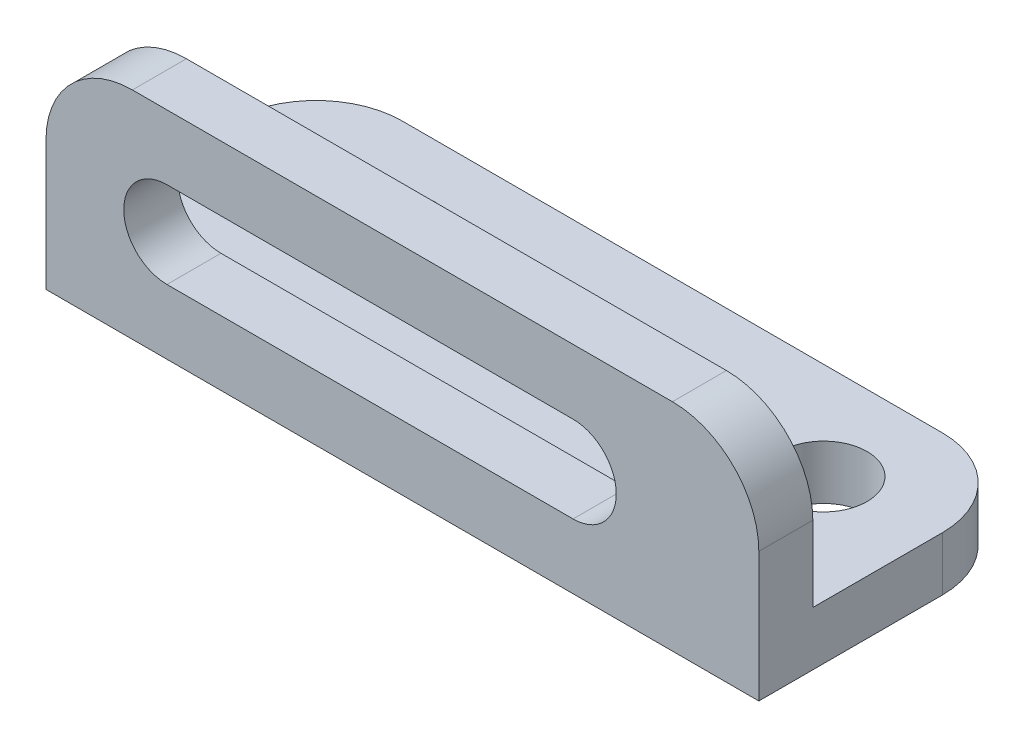
from build123d import *

# Parameters (mm, degrees)
SKETCH1_W           = 41.91
SKETCH1_H           = 15.875
BOSS_EXTRUDE1_DEPTH = 12.7
SKETCH2_W           = 12.7
SKETCH2_H           = 9.525
CUT_EXTRUDE1_DEPTH  = 46.263519803
CUT_EXTRUDE2_DEPTH  = 28.045335088
HOLE1_D             = 5.1054
HOLE1_DEPTH         = 12.7
FILLET1_R           = 5.08


with BuildPart() as part:
    # Sketch1 → Boss-Extrude1 (new body)
    with BuildSketch(Plane(origin=(0, 6.35, 0), x_dir=(1, 0, 0), z_dir=(0, 1, 0))):
        with Locations((0, 7.9375)):
            Rectangle(SKETCH1_W, SKETCH1_H)
    extrude(amount=-BOSS_EXTRUDE1_DEPTH)

    # Sketch2 → Cut-Extrude1 (cut, through all)
    with BuildSketch(Plane(origin=(20.955, 0, 0), x_dir=(0, 0, -1), z_dir=(1, 0, 0))):
        with Locations((9.525, 1.5875)):
            Rectangle(SKETCH2_W, SKETCH2_H)
    extrude(amount=-CUT_EXTRUDE1_DEPTH, mode=Mode.SUBTRACT)

    # Sketch3 → Cut-Extrude2 (cut, through all)
    with BuildSketch(Plane.XY):
        with BuildLine():
            Line((-13.843, -2.54), (10.033, -2.54))
            ThreePointArc((10.033, -2.54), (12.573, 0), (10.033, 2.54))
            Line((10.033, 2.54), (-13.843, 2.54))
            ThreePointArc((-13.843, 2.54), (-16.383, 0), (-13.843, -2.54))
        make_face()
    extrude(amount=-CUT_EXTRUDE2_DEPTH, mode=Mode.SUBTRACT)

    # Hole1
    with Locations(Plane(origin=(0, -6.35, 0), x_dir=(-1, 0, 0), z_dir=(0, -1, 0))):
        with Locations((10.795, 10.16), (-14.605, 10.16)):
            Hole(HOLE1_D / 2, depth=HOLE1_DEPTH)

    # Fillet1
    fillet1_edges = [part.edges().sort_by_distance(p)[0] for p in [
        (-20.955, 6.35, -1.5875),
        (20.955, 6.35, -1.5875),
        (-20.955, -4.7625, -15.875),
        (20.955, -4.7625, -15.875),
    ]]
    fillet(fillet1_edges, radius=FILLET1_R)


solid = part.part
